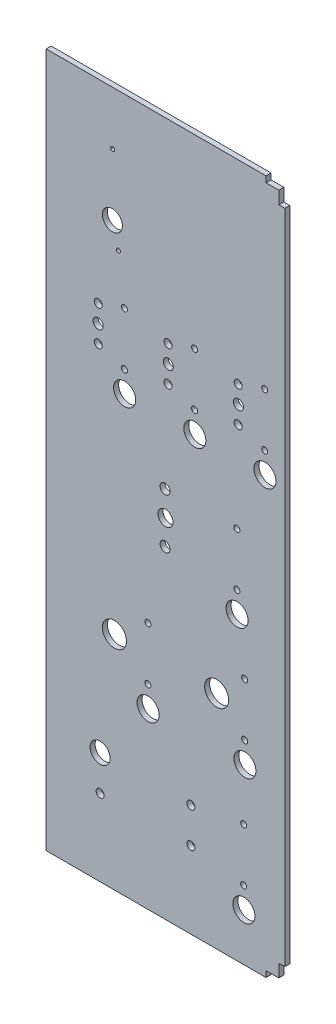
from build123d import *

# Parameters (mm, degrees)
SKETCH1_W           = 302.3362
SKETCH1_H           = 879.8306
BOSS_EXTRUDE1_DEPTH = 6.35
SKETCH2_R           = 5.08
SKETCH2_R_2         = 12.7
CUT_EXTRUDE1_DEPTH  = 931.349066226
SKETCH3_R           = 3.81
CUT_EXTRUDE2_DEPTH  = 931.349066226
SKETCH4_R           = 15.24
CUT_EXTRUDE3_DEPTH  = 931.349066226
SKETCH5_R           = 13.97
CUT_EXTRUDE4_DEPTH  = 931.349066226
SKETCH6_R           = 9.525
SKETCH6_R_2         = 6.35
CUT_EXTRUDE5_DEPTH  = 931.349066226
SKETCH7_R           = 6.35
SKETCH7_R_2         = 5.08
CUT_EXTRUDE6_DEPTH  = 931.349066226
SKETCH8_R           = 2.54
CUT_EXTRUDE7_DEPTH  = 931.349066226
SKETCH9_R           = 12.7
CUT_EXTRUDE8_DEPTH  = 931.349066226


with BuildPart() as part:
    # Sketch1 → Boss-Extrude1 (new body)
    with BuildSketch(Plane.XY):
        with Locations((151.1681, 439.9153)):
            Rectangle(SKETCH1_W, SKETCH1_H)
    extrude(amount=BOSS_EXTRUDE1_DEPTH)

    # Sketch2 → Cut-Extrude1 (cut, through all)
    with BuildSketch(Plane.XY.offset(6.35)):
        with Locations((68.3387, 97.1296)):
            Circle(SKETCH2_R)
        with Locations((68.3387, 141.6304)):
            Circle(SKETCH2_R_2)
        with Locations((183.2737, 97.1296)):
            Circle(SKETCH2_R)
        with Locations((183.2737, 141.6304)):
            Circle(SKETCH2_R)
    extrude(amount=-CUT_EXTRUDE1_DEPTH, mode=Mode.SUBTRACT)

    # Sketch3 → Cut-Extrude2 (cut, through all)
    with BuildSketch(Plane.XY.offset(6.35)):
        with Locations((250.2662, 87.122)):
            Circle(SKETCH3_R)
        with Locations((250.2662, 154.178)):
            Circle(SKETCH3_R)
        with Locations((251.5362, 247.142)):
            Circle(SKETCH3_R)
        with Locations((251.5362, 314.198)):
            Circle(SKETCH3_R)
        with Locations((128.8542, 247.142)):
            Circle(SKETCH3_R)
        with Locations((128.8542, 314.198)):
            Circle(SKETCH3_R)
        with Locations((241.6302, 407.1366)):
            Circle(SKETCH3_R)
        with Locations((241.6302, 474.1926)):
            Circle(SKETCH3_R)
        with Locations((276.9362, 577.8246)):
            Circle(SKETCH3_R)
        with Locations((276.9362, 644.8806)):
            Circle(SKETCH3_R)
        with Locations((188.0362, 577.8246)):
            Circle(SKETCH3_R)
        with Locations((188.0362, 644.8806)):
            Circle(SKETCH3_R)
        with Locations((99.1362, 577.8246)):
            Circle(SKETCH3_R)
        with Locations((99.1362, 644.8806)):
            Circle(SKETCH3_R)
    extrude(amount=-CUT_EXTRUDE2_DEPTH, mode=Mode.SUBTRACT)

    # Sketch4 → Cut-Extrude3 (cut, through all)
    with BuildSketch(Plane.XY.offset(6.35)):
        with Locations((86.4362, 280.67)):
            Circle(SKETCH4_R)
        with Locations((215.9762, 280.67)):
            Circle(SKETCH4_R)
    extrude(amount=-CUT_EXTRUDE3_DEPTH, mode=Mode.SUBTRACT)

    # Sketch5 → Cut-Extrude4 (cut, through all)
    with BuildSketch(Plane.XY.offset(6.35)):
        with Locations((250.5202, 60.245134418)):
            Circle(SKETCH5_R)
        with Locations((251.7902, 220.265134418)):
            Circle(SKETCH5_R)
        with Locations((129.1082, 220.265134418)):
            Circle(SKETCH5_R)
        with Locations((241.8842, 380.259734418)):
            Circle(SKETCH5_R)
        with Locations((277.1902, 550.947734418)):
            Circle(SKETCH5_R)
        with Locations((188.2902, 550.947734418)):
            Circle(SKETCH5_R)
        with Locations((99.3902, 550.947734418)):
            Circle(SKETCH5_R)
    extrude(amount=-CUT_EXTRUDE4_DEPTH, mode=Mode.SUBTRACT)

    # Sketch6 → Cut-Extrude5 (cut, through all)
    with BuildSketch(Plane.XY.offset(6.35)):
        with Locations((151.1427, 440.6646)):
            Circle(SKETCH6_R)
        with Locations((243.5987, 611.3526)):
            Circle(SKETCH6_R_2)
        with Locations((154.6987, 611.3526)):
            Circle(SKETCH6_R_2)
        with Locations((65.7987, 611.3526)):
            Circle(SKETCH6_R_2)
    extrude(amount=-CUT_EXTRUDE5_DEPTH, mode=Mode.SUBTRACT)

    # Sketch7 → Cut-Extrude6 (cut, through all)
    with BuildSketch(Plane.XY.offset(6.35)):
        with Locations((150.646633261, 408.918475547)):
            Circle(SKETCH7_R)
        with Locations((150.646633261, 472.410724453)):
            Circle(SKETCH7_R)
        with Locations((65.961389674, 589.137523749)):
            Circle(SKETCH7_R_2)
        with Locations((65.961389674, 633.567676251)):
            Circle(SKETCH7_R_2)
        with Locations((154.359991886, 589.137523749)):
            Circle(SKETCH7_R_2)
        with Locations((154.359991886, 633.567676251)):
            Circle(SKETCH7_R_2)
        with Locations((243.259991886, 589.137523749)):
            Circle(SKETCH7_R_2)
        with Locations((243.259991886, 633.567676251)):
            Circle(SKETCH7_R_2)
    extrude(amount=-CUT_EXTRUDE6_DEPTH, mode=Mode.SUBTRACT)

    # Sketch8 → Cut-Extrude7 (cut, through all)
    with BuildSketch(Plane.XY.offset(6.35)):
        with Locations((84.2645, 811.9745)):
            Circle(SKETCH8_R)
        with Locations((91.57335, 704.25945)):
            Circle(SKETCH8_R)
    extrude(amount=-CUT_EXTRUDE7_DEPTH, mode=Mode.SUBTRACT)

    # Sketch9 → Cut-Extrude8 (cut, through all)
    with BuildSketch(Plane.XY.offset(6.35)):
        with Locations((83.82, 733.7806)):
            Circle(SKETCH9_R)
        Polygon((278.5872, 0), (278.5872, 7.62), (294.7162, 7.62), (294.7162, 23.749), (302.3362, 23.749), (302.3362, 0), align=None)
        Polygon((302.3362, 879.8306), (302.3362, 856.0816), (294.7162, 856.0816), (294.7162, 872.2106), (278.5872, 872.2106), (278.5872, 879.8306), align=None)
    extrude(amount=-CUT_EXTRUDE8_DEPTH, mode=Mode.SUBTRACT)


solid = part.part
